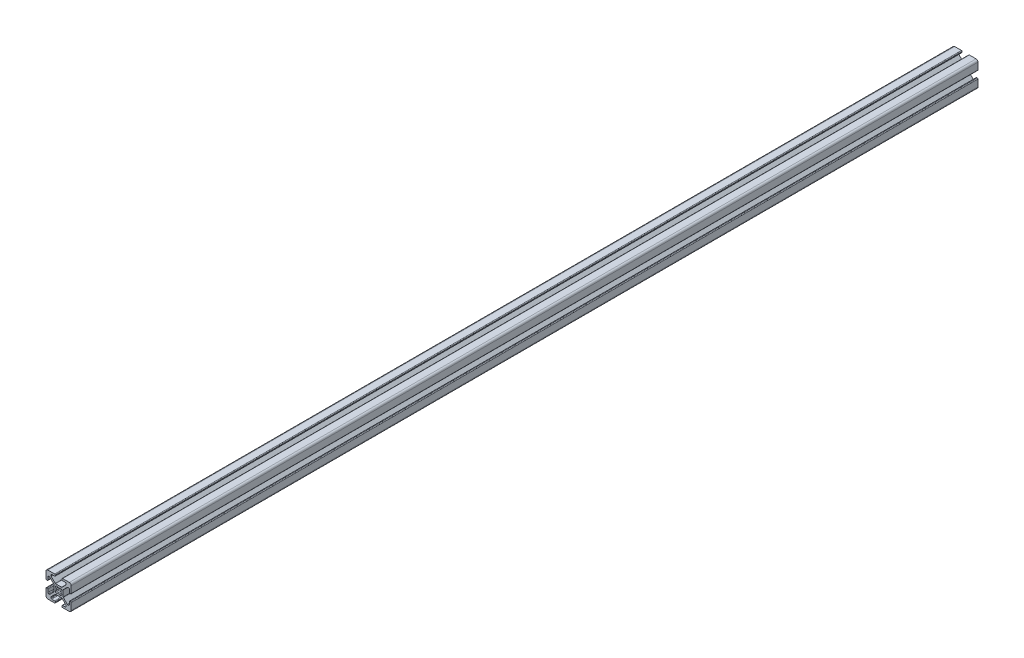
from build123d import *

# Parameters (mm, degrees)
EXTRUDE1_DEPTH = 720


with BuildPart() as part:
    # Sketch1 → Extrude1 (new body)
    with BuildSketch(Plane.XY):
        with BuildLine():
            Line((-5.032287798, -0.341059771), (-5.516287798, -0.341059771))
            ThreePointArc((-5.516287798, -0.341059771), (-5.875498042, -0.192270016), (-6.024287798, 0.166940229))
            Line((-6.024287798, 0.166940229), (-6.024287798, 2.515940229))
            ThreePointArc((-6.024287798, 2.515940229), (-6.173077553, 2.875150474), (-6.532287798, 3.023940229))
            Line((-6.532287798, 3.023940229), (-7.258207136, 3.023940229))
            ThreePointArc((-7.258207136, 3.023940229), (-7.45261032, 2.985271032), (-7.617417381, 2.875150474))
            Line((-7.617417381, 2.875150474), (-10.720498042, -0.227930187))
            ThreePointArc((-10.720498042, -0.227930187), (-10.8306186, -0.392737249), (-10.869287798, -0.587140432))
            Line((-10.869287798, -0.587140432), (-10.869287798, -5.354979109))
            ThreePointArc((-10.869287798, -5.354979109), (-10.8306186, -5.549382293), (-10.720498042, -5.714189354))
            Line((-10.720498042, -5.714189354), (-7.617417381, -8.817270016))
            ThreePointArc((-7.617417381, -8.817270016), (-7.45261032, -8.927390573), (-7.258207136, -8.966059771))
            Line((-7.258207136, -8.966059771), (-6.532287798, -8.966059771))
            ThreePointArc((-6.532287798, -8.966059771), (-6.173077553, -8.817270016), (-6.024287798, -8.458059771))
            Line((-6.024287798, -8.458059771), (-6.024287798, -6.109059771))
            ThreePointArc((-6.024287798, -6.109059771), (-5.875498042, -5.749849526), (-5.516287798, -5.601059771))
            Line((-5.516287798, -5.601059771), (-5.032287798, -5.601059771))
            ThreePointArc((-5.032287798, -5.601059771), (-4.673077553, -5.749849526), (-4.524287798, -6.109059771))
            Line((-4.524287798, -6.109059771), (-4.524287798, -11.471059771))
            ThreePointArc((-4.524287798, -11.471059771), (-4.963627626, -12.531719943), (-6.024287798, -12.971059771))
            Line((-6.024287798, -12.971059771), (-11.386287798, -12.971059771))
            ThreePointArc((-11.386287798, -12.971059771), (-11.745498042, -12.822270016), (-11.894287798, -12.463059771))
            Line((-11.894287798, -12.463059771), (-11.894287798, -11.979059771))
            ThreePointArc((-11.894287798, -11.979059771), (-11.745498042, -11.619849526), (-11.386287798, -11.471059771))
            Line((-11.386287798, -11.471059771), (-9.037287798, -11.471059771))
            ThreePointArc((-9.037287798, -11.471059771), (-8.678077553, -11.322270016), (-8.529287798, -10.963059771))
            Line((-8.529287798, -10.963059771), (-8.529287798, -10.237140432))
            ThreePointArc((-8.529287798, -10.237140432), (-8.567956995, -10.042737249), (-8.678077553, -9.877930187))
            Line((-8.678077553, -9.877930187), (-11.781158214, -6.774849526))
            ThreePointArc((-11.781158214, -6.774849526), (-11.945965275, -6.664728968), (-12.140368459, -6.626059771))
            Line((-12.140368459, -6.626059771), (-16.908207136, -6.626059771))
            ThreePointArc((-16.908207136, -6.626059771), (-17.10261032, -6.664728968), (-17.267417381, -6.774849526))
            Line((-17.267417381, -6.774849526), (-20.370498042, -9.877930187))
            ThreePointArc((-20.370498042, -9.877930187), (-20.4806186, -10.042737249), (-20.519287798, -10.237140432))
            Line((-20.519287798, -10.237140432), (-20.519287798, -10.963059771))
            ThreePointArc((-20.519287798, -10.963059771), (-20.370498042, -11.322270016), (-20.011287798, -11.471059771))
            Line((-20.011287798, -11.471059771), (-17.662287798, -11.471059771))
            ThreePointArc((-17.662287798, -11.471059771), (-17.303077553, -11.619849526), (-17.154287798, -11.979059771))
            Line((-17.154287798, -11.979059771), (-17.154287798, -12.463059771))
            ThreePointArc((-17.154287798, -12.463059771), (-17.303077553, -12.822270016), (-17.662287798, -12.971059771))
            Line((-17.662287798, -12.971059771), (-23.024287798, -12.971059771))
            ThreePointArc((-23.024287798, -12.971059771), (-24.084947969, -12.531719943), (-24.524287798, -11.471059771))
            Line((-24.524287798, -11.471059771), (-24.524287798, -6.109059771))
            ThreePointArc((-24.524287798, -6.109059771), (-24.375498042, -5.749849526), (-24.016287798, -5.601059771))
            Line((-24.016287798, -5.601059771), (-23.532287798, -5.601059771))
            ThreePointArc((-23.532287798, -5.601059771), (-23.173077553, -5.749849526), (-23.024287798, -6.109059771))
            Line((-23.024287798, -6.109059771), (-23.024287798, -8.458059771))
            ThreePointArc((-23.024287798, -8.458059771), (-22.875498042, -8.817270016), (-22.516287798, -8.966059771))
            Line((-22.516287798, -8.966059771), (-21.790368459, -8.966059771))
            ThreePointArc((-21.790368459, -8.966059771), (-21.595965275, -8.927390573), (-21.431158214, -8.817270016))
            Line((-21.431158214, -8.817270016), (-18.328077553, -5.714189354))
            ThreePointArc((-18.328077553, -5.714189354), (-18.217956995, -5.549382293), (-18.179287798, -5.354979109))
            Line((-18.179287798, -5.354979109), (-18.179287798, -0.587140432))
            ThreePointArc((-18.179287798, -0.587140432), (-18.217956995, -0.392737249), (-18.328077553, -0.227930187))
            Line((-18.328077553, -0.227930187), (-21.431158214, 2.875150474))
            ThreePointArc((-21.431158214, 2.875150474), (-21.595965275, 2.985271032), (-21.790368459, 3.023940229))
            Line((-21.790368459, 3.023940229), (-22.516287798, 3.023940229))
            ThreePointArc((-22.516287798, 3.023940229), (-22.875498042, 2.875150474), (-23.024287798, 2.515940229))
            Line((-23.024287798, 2.515940229), (-23.024287798, 0.166940229))
            ThreePointArc((-23.024287798, 0.166940229), (-23.173077553, -0.192270016), (-23.532287798, -0.341059771))
            Line((-23.532287798, -0.341059771), (-24.016287798, -0.341059771))
            ThreePointArc((-24.016287798, -0.341059771), (-24.375498042, -0.192270016), (-24.524287798, 0.166940229))
            Line((-24.524287798, 0.166940229), (-24.524287798, 5.528940229))
            ThreePointArc((-24.524287798, 5.528940229), (-24.084947969, 6.589600401), (-23.024287798, 7.028940229))
            Line((-23.024287798, 7.028940229), (-17.662287798, 7.028940229))
            ThreePointArc((-17.662287798, 7.028940229), (-17.303077553, 6.880150474), (-17.154287798, 6.520940229))
            Line((-17.154287798, 6.520940229), (-17.154287798, 6.036940229))
            ThreePointArc((-17.154287798, 6.036940229), (-17.303077553, 5.677729984), (-17.662287798, 5.528940229))
            Line((-17.662287798, 5.528940229), (-20.011287798, 5.528940229))
            ThreePointArc((-20.011287798, 5.528940229), (-20.370498042, 5.380150474), (-20.519287798, 5.020940229))
            Line((-20.519287798, 5.020940229), (-20.519287798, 4.295020891))
            ThreePointArc((-20.519287798, 4.295020891), (-20.4806186, 4.100617707), (-20.370498042, 3.935810646))
            Line((-20.370498042, 3.935810646), (-17.267417381, 0.832729984))
            ThreePointArc((-17.267417381, 0.832729984), (-17.10261032, 0.722609427), (-16.908207136, 0.683940229))
            Line((-16.908207136, 0.683940229), (-12.140368459, 0.683940229))
            ThreePointArc((-12.140368459, 0.683940229), (-11.945965275, 0.722609427), (-11.781158214, 0.832729984))
            Line((-11.781158214, 0.832729984), (-8.678077553, 3.935810646))
            ThreePointArc((-8.678077553, 3.935810646), (-8.567956995, 4.100617707), (-8.529287798, 4.295020891))
            Line((-8.529287798, 4.295020891), (-8.529287798, 5.020940229))
            ThreePointArc((-8.529287798, 5.020940229), (-8.678077553, 5.380150474), (-9.037287798, 5.528940229))
            Line((-9.037287798, 5.528940229), (-11.386287798, 5.528940229))
            ThreePointArc((-11.386287798, 5.528940229), (-11.745498042, 5.677729984), (-11.894287798, 6.036940229))
            Line((-11.894287798, 6.036940229), (-11.894287798, 6.520940229))
            ThreePointArc((-11.894287798, 6.520940229), (-11.745498042, 6.880150474), (-11.386287798, 7.028940229))
            Line((-11.386287798, 7.028940229), (-6.024287798, 7.028940229))
            ThreePointArc((-6.024287798, 7.028940229), (-4.963627626, 6.589600401), (-4.524287798, 5.528940229))
            Line((-4.524287798, 5.528940229), (-4.524287798, 0.166940229))
            ThreePointArc((-4.524287798, 0.166940229), (-4.673077553, -0.192270016), (-5.032287798, -0.341059771))
        make_face()
        with BuildLine():
            Line((-12.399386954, -5.275565737), (-12.219781831, -5.095960615))
            ThreePointArc((-12.219781831, -5.095960615), (-12.018349781, -4.327527582), (-12.589154291, -3.775036489))
            ThreePointArc((-12.589154291, -3.775036489), (-12.428787798, -2.971059771), (-12.589154291, -2.167083053))
            ThreePointArc((-12.589154291, -2.167083053), (-12.018349781, -1.61459196), (-12.219781831, -0.846158927))
            Line((-12.219781831, -0.846158927), (-12.399386954, -0.666553805))
            ThreePointArc((-12.399386954, -0.666553805), (-13.167819987, -0.465121754), (-13.72031108, -1.035926265))
            ThreePointArc((-13.72031108, -1.035926265), (-14.524287798, -0.875559771), (-15.328264516, -1.035926265))
            ThreePointArc((-15.328264516, -1.035926265), (-15.880755608, -0.465121754), (-16.649188641, -0.666553805))
            Line((-16.649188641, -0.666553805), (-16.828793764, -0.846158927))
            ThreePointArc((-16.828793764, -0.846158927), (-17.030225814, -1.61459196), (-16.459421304, -2.167083053))
            ThreePointArc((-16.459421304, -2.167083053), (-16.619787798, -2.971059771), (-16.459421304, -3.775036489))
            ThreePointArc((-16.459421304, -3.775036489), (-17.030225814, -4.327527582), (-16.828793764, -5.095960615))
            Line((-16.828793764, -5.095960615), (-16.649188641, -5.275565737))
            ThreePointArc((-16.649188641, -5.275565737), (-15.880755608, -5.476997788), (-15.328264516, -4.906193277))
            ThreePointArc((-15.328264516, -4.906193277), (-14.524287798, -5.066559771), (-13.72031108, -4.906193277))
            ThreePointArc((-13.72031108, -4.906193277), (-13.167819987, -5.476997788), (-12.399386954, -5.275565737))
        make_face(mode=Mode.SUBTRACT)
    extrude(amount=EXTRUDE1_DEPTH)


solid = part.part
